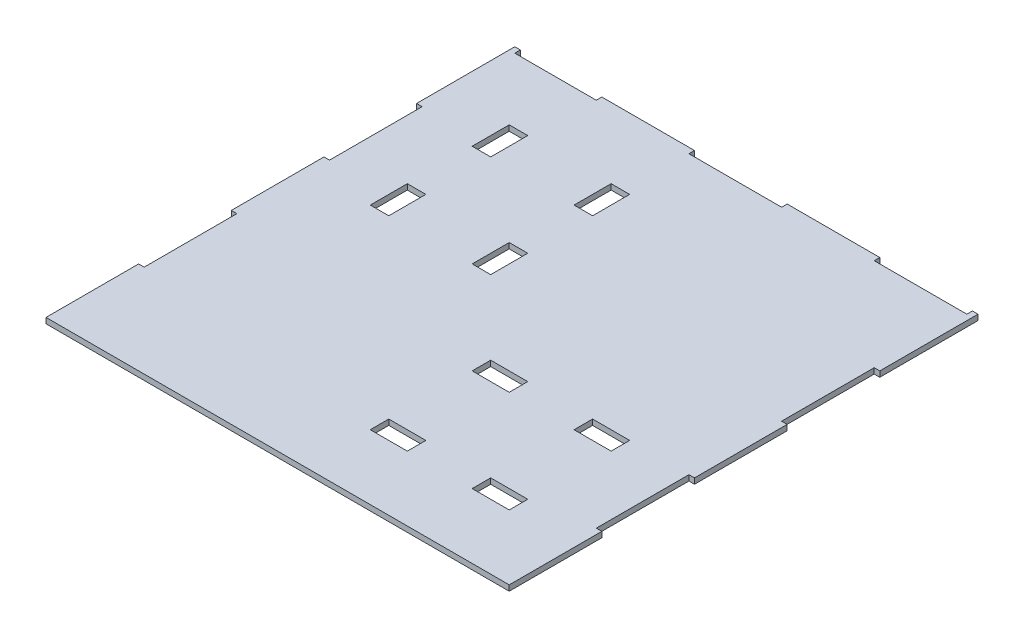
from build123d import *

# Parameters (mm, degrees)
SKETCH1_W           = 10
SKETCH1_H           = 20
SKETCH1_W_2         = 20
SKETCH1_H_2         = 10
BOSS_EXTRUDE1_DEPTH = 3


with BuildPart() as part:
    # Sketch1 → Boss-Extrude1 (new body)
    with BuildSketch(Plane(origin=(0, 0, 0), x_dir=(1, 0, 0), z_dir=(0, 1, 0))):
        Polygon((250, 100), (250, 150), (247, 150), (247, 200), (250, 200), (250, 250), (250, 253), (247, 253), (247, 250), (197, 250), (197, 253), (147, 253), (147, 250), (97, 250), (97, 253), (47, 253), (47, 250), (3, 250), (3, 253), (0, 253), (0, 250), (0, 200), (3, 200), (3, 150), (0, 150), (0, 100), (3, 100), (3, 50), (0, 50), (0, 0), (250, 0), (250, 50), (247, 50), (247, 100), align=None)
        with Locations((95, 150)):
            Rectangle(SKETCH1_W, SKETCH1_H, mode=Mode.SUBTRACT)
        with Locations((40, 150)):
            Rectangle(SKETCH1_W, SKETCH1_H, mode=Mode.SUBTRACT)
        with Locations((205, 95)):
            Rectangle(SKETCH1_W_2, SKETCH1_H_2, mode=Mode.SUBTRACT)
        with Locations((205, 40)):
            Rectangle(SKETCH1_W_2, SKETCH1_H_2, mode=Mode.SUBTRACT)
        with Locations((40, 205)):
            Rectangle(SKETCH1_W, SKETCH1_H, mode=Mode.SUBTRACT)
        with Locations((95, 205)):
            Rectangle(SKETCH1_W, SKETCH1_H, mode=Mode.SUBTRACT)
        with Locations((150, 95)):
            Rectangle(SKETCH1_W_2, SKETCH1_H_2, mode=Mode.SUBTRACT)
        with Locations((150, 40)):
            Rectangle(SKETCH1_W_2, SKETCH1_H_2, mode=Mode.SUBTRACT)
    extrude(amount=BOSS_EXTRUDE1_DEPTH)


solid = part.part
